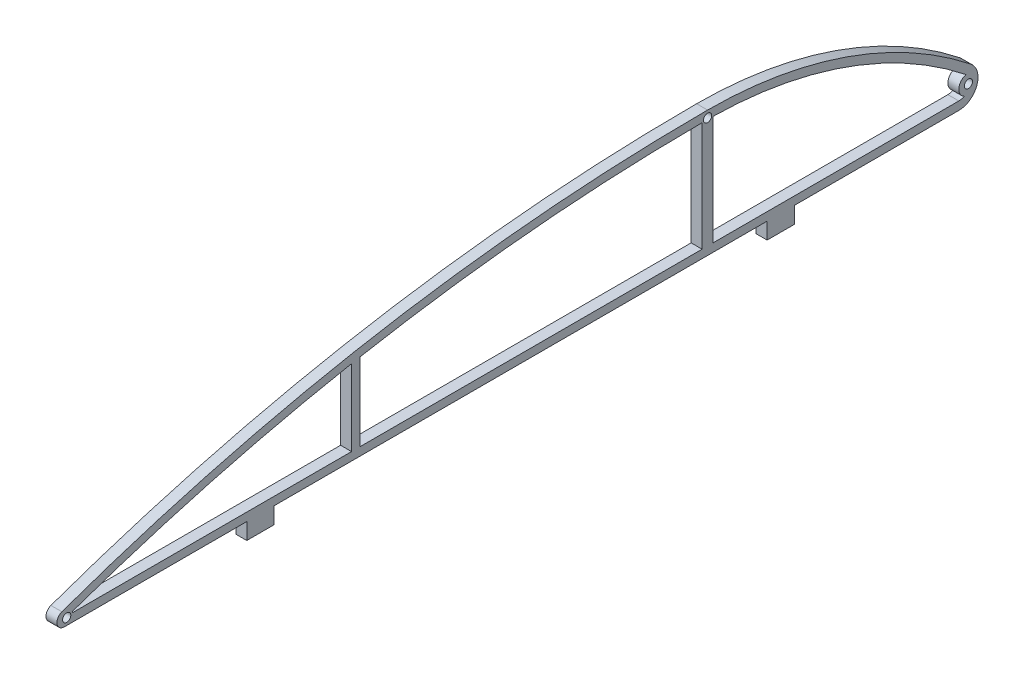
from build123d import *

# Parameters (mm, degrees)
BOSS_EXTRU_1_DEPTH      = 2
ESQUISSE4_R             = 0.75
ENL_V_MAT_EXTRU_2_DEPTH = 176.894862906
ENL_V_MAT_EXTRU_3_DEPTH = 4
CONG_2_R                = 1.35
ESQUISSE12_W            = 2
ESQUISSE12_H            = 5
BOSS_EXTRU_2_DEPTH      = 3


with BuildPart() as part:
    # Esquisse2 → Boss.-Extru.1 (new body)
    with BuildSketch(Plane(origin=(0, 0, 0), x_dir=(0, 0, -1), z_dir=(1, 0, 0))):
        with BuildLine():
            Line((0, 0), (170.873171093, 0))
            ThreePointArc((170.873171093, 0), (174.177922559, 2.347343181), (173.049882129, 6.240789861))
            ThreePointArc((173.049882129, 6.240789861), (150.444362328, 18.689979585), (125, 23))
            ThreePointArc((125, 23), (61.450806457, 17.202138822), (0, 0))
        make_face()
    extrude(amount=BOSS_EXTRU_1_DEPTH)

    # Esquisse4 → Enlèv. mat.-Extru.2 (cut, through all)
    with BuildSketch(Plane(origin=(2, 0, 0), x_dir=(0, 0, -1), z_dir=(1, 0, 0))):
        with Locations((125, 21.75)):
            Circle(ESQUISSE4_R)
        with Locations((172.618958832, 3.328337296)):
            Circle(ESQUISSE4_R)
        with Locations((8, 1.25)):
            Circle(ESQUISSE4_R)
    extrude(amount=-ENL_V_MAT_EXTRU_2_DEPTH, mode=Mode.SUBTRACT)

    # Esquisse9 → Enlèv. mat.-Extru.3 (cut)
    with BuildSketch(Plane(origin=(0, 0, 0), x_dir=(0, 0, -1), z_dir=(1, 0, 0))):
        with BuildLine():
            Line((126, 1.5), (170.873171093, 1.5))
            ThreePointArc((170.873171093, 1.5), (171.378747106, 1.564956617), (171.851482612, 1.755607106))
            ThreePointArc((171.851482612, 1.755607106), (170.877358103, 3.499588293), (172.172511728, 5.020432147))
            ThreePointArc((172.172511728, 5.020432147), (172.144964437, 5.043548409), (172.11700597, 5.066165635))
            ThreePointArc((172.11700597, 5.066165635), (150.432293025, 17.103742315), (126.021977416, 21.493106696))
            ThreePointArc((126.021977416, 21.493106696), (126.011314857, 21.467285013), (126, 21.441742431))
            Line((126, 21.441742431), (126, 1.5))
        make_face()
        with BuildLine():
            Line((9.071214264, 1.5), (60, 1.5))
            Line((60, 1.5), (60, 15.405547145))
            ThreePointArc((60, 15.405547145), (34.242807282, 9.516740415), (9.003792697, 1.699889121))
            ThreePointArc((9.003792697, 1.699889121), (9.042306283, 1.601564521), (9.071214264, 1.5))
        make_face()
        with BuildLine():
            Line((124, 21.441742431), (124, 1.5))
            Line((124, 1.5), (61.5, 1.5))
            Line((61.5, 1.5), (61.5, 15.685935533))
            ThreePointArc((61.5, 15.685935533), (92.607306096, 19.996388454), (123.975891605, 21.498500317))
            ThreePointArc((123.975891605, 21.498500317), (123.987547995, 21.469952401), (124, 21.441742431))
        make_face()
    extrude(amount=ENL_V_MAT_EXTRU_3_DEPTH, mode=Mode.SUBTRACT)

    # Congé2
    cong_2_edges = [part.edges().sort_by_distance(p)[0] for p in [
        (1, 0, 0),
    ]]
    fillet(cong_2_edges, radius=CONG_2_R)

    # Esquisse12 → Boss.-Extru.2 (add)
    with BuildSketch(Plane.XZ):
        with Locations((1, -138.373171093)):
            Rectangle(ESQUISSE12_W, ESQUISSE12_H)
        with Locations((1, -43.373171093)):
            Rectangle(ESQUISSE12_W, ESQUISSE12_H)
    extrude(amount=BOSS_EXTRU_2_DEPTH)


solid = part.part
